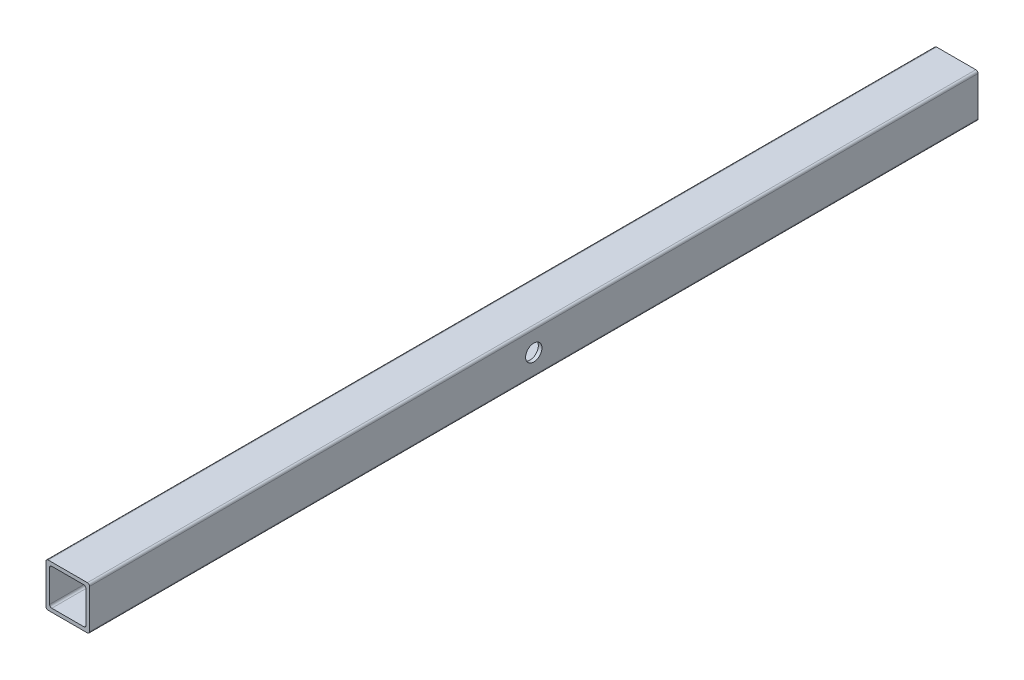
from build123d import *

# Parameters (mm, degrees)
BOSS_EXTRUDE1_DEPTH = 518.16
SKETCH2_R           = 4.7625
CUT_EXTRUDE1_DEPTH  = 520.304779053


with BuildPart() as part:
    # Sketch1 → Boss-Extrude1 (new body)
    with BuildSketch(Plane.XY):
        with BuildLine():
            Line((-0.8382, 23.2918), (22.0218, 23.2918))
            ThreePointArc((22.0218, 23.2918), (22.919825612, 22.919825612), (23.2918, 22.0218))
            Line((23.2918, 22.0218), (23.2918, -0.8382))
            ThreePointArc((23.2918, -0.8382), (22.919825612, -1.736225612), (22.0218, -2.1082))
            Line((22.0218, -2.1082), (-0.8382, -2.1082))
            ThreePointArc((-0.8382, -2.1082), (-1.736225612, -1.736225612), (-2.1082, -0.8382))
            Line((-2.1082, -0.8382), (-2.1082, 22.0218))
            ThreePointArc((-2.1082, 22.0218), (-1.736225612, 22.919825612), (-0.8382, 23.2918))
        make_face()
        with BuildLine():
            Line((1.27, 0), (19.9136, 0))
            ThreePointArc((19.9136, 0), (20.811625612, 0.371974388), (21.1836, 1.27))
            Line((21.1836, 1.27), (21.1836, 19.9136))
            ThreePointArc((21.1836, 19.9136), (20.811625612, 20.811625612), (19.9136, 21.1836))
            Line((19.9136, 21.1836), (1.27, 21.1836))
            ThreePointArc((1.27, 21.1836), (0.371974388, 20.811625612), (0, 19.9136))
            Line((0, 19.9136), (0, 1.27))
            ThreePointArc((0, 1.27), (0.371974388, 0.371974388), (1.27, 0))
        make_face(mode=Mode.SUBTRACT)
    extrude(amount=BOSS_EXTRUDE1_DEPTH)

    # Sketch2 → Cut-Extrude1 (cut, through all)
    with BuildSketch(Plane.ZY.offset(2.1082)):
        with Locations(Location((259.08, 10.5918, 0), (0, 0, 270))):
            Circle(SKETCH2_R)
    extrude(amount=-CUT_EXTRUDE1_DEPTH, mode=Mode.SUBTRACT)


solid = part.part
